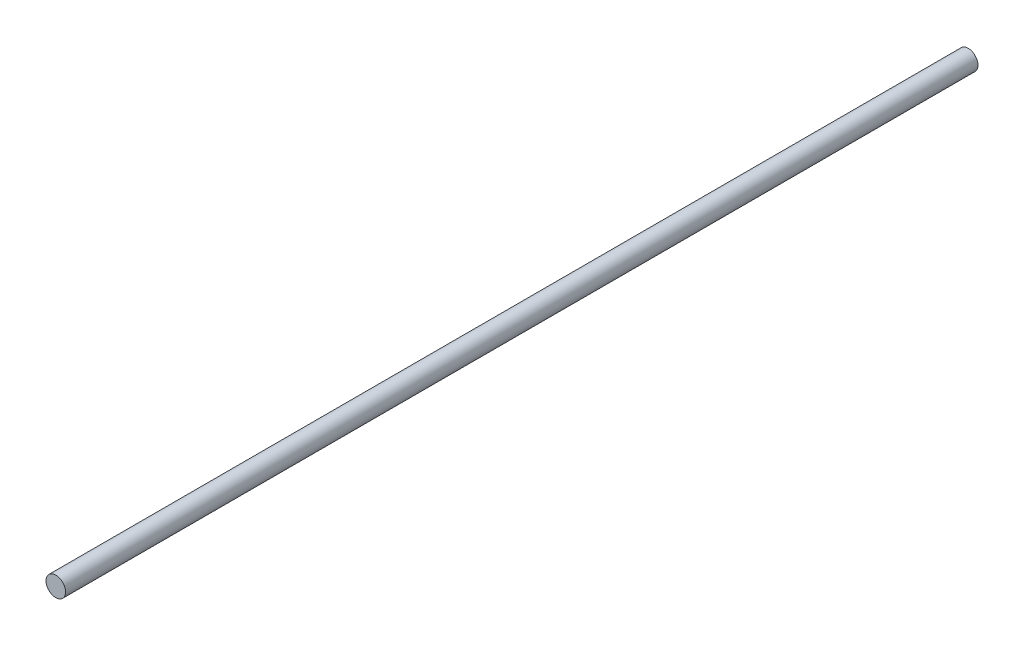
from build123d import *

# Parameters (mm, degrees)
ESQUISSE1_R        = 3
BOSS_EXTRU_1_DEPTH = 280


with BuildPart() as part:
    # Esquisse1 → Boss.-Extru.1 (new body)
    with BuildSketch(Plane.XY):
        Circle(ESQUISSE1_R)
    extrude(amount=BOSS_EXTRU_1_DEPTH)


solid = part.part
